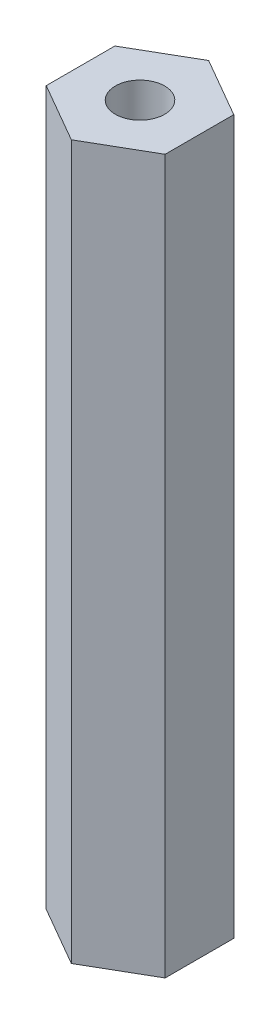
from build123d import *

# Parameters (mm, degrees)
SKETCH1_R           = 2.6289
BOSS_EXTRUDE1_DEPTH = 76.2


with BuildPart() as part:
    # Sketch1 → Boss-Extrude1 (new body)
    with BuildSketch(Plane(origin=(0, 0, 0), x_dir=(1, 0, 0), z_dir=(0, 1, 0))):
        Polygon((0, 7.332348419), (-6.35, 3.666174209), (-6.35, -3.666174209), (0, -7.332348419), (6.35, -3.666174209), (6.35, 3.666174209), align=None)
        with Locations(Location((0, 0, 0), (0, 0, 90))):
            Circle(SKETCH1_R, mode=Mode.SUBTRACT)
    extrude(amount=BOSS_EXTRUDE1_DEPTH)


solid = part.part
